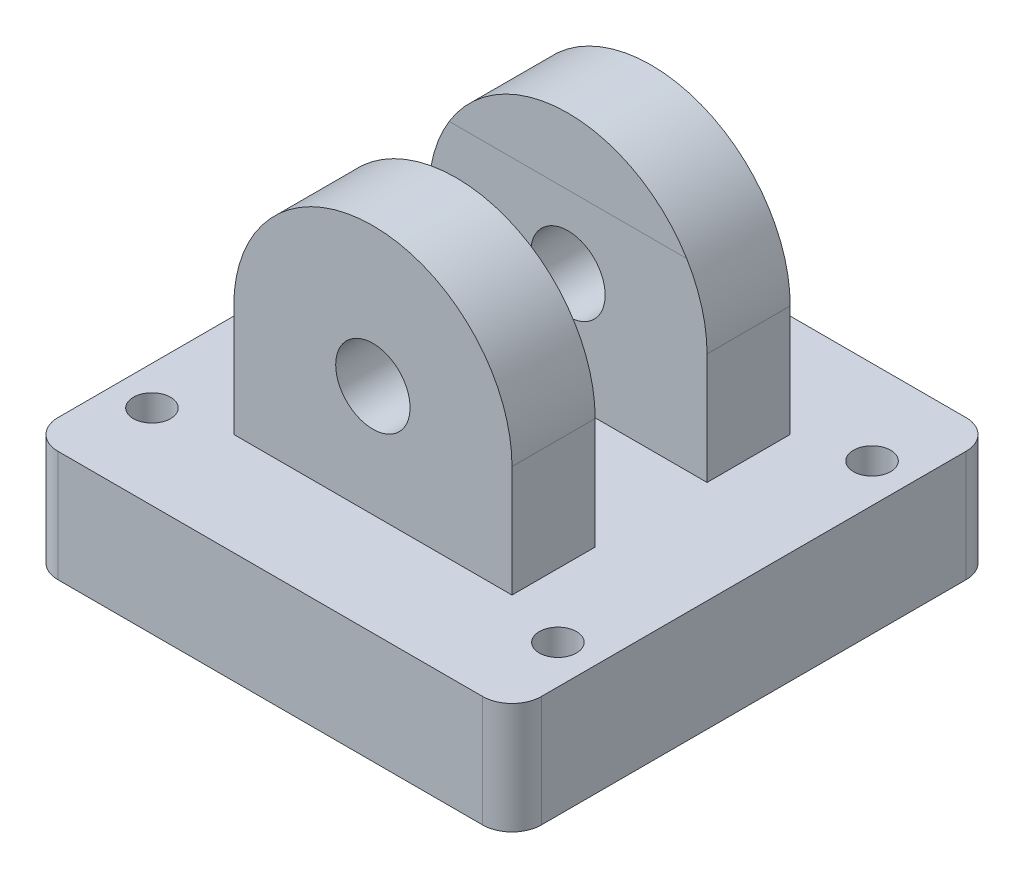
from build123d import *

# Parameters (mm, degrees)
SKETCH1_W                              = 165
SKETCH1_H                              = 165
BOSS_EXTRUDE1_DEPTH                    = 38
SKETCH2_W                              = 95
SKETCH2_H                              = 95
BOSS_EXTRUDE2_DEPTH                    = 38
BOSS_EXTRUDE4_DEPTH                    = 95
SKETCH5_R                              = 12.7
CUT_EXTRUDE1_DEPTH                     = 198.379076905
CUT_EXTRUDE2_DEPTH                     = 222.998873871
CUT_EXTRUDE2_DEPTH_BACK                = 222.998873871
FILLET1_R                              = 10
FILLET2_R                              = 10
SKETCH9_R                              = 26
CUT_EXTRUDE3_DEPTH                     = 36.83
SKETCH10_R                             = 76.2
SKETCH10_R_2                           = 69.85
CUT_EXTRUDE4_DEPTH                     = 10
F_1_2_14_NPSM_TAPPED_HOLE1_D           = 18.9738
F_1_2_14_NPSM_TAPPED_HOLE1_DEPTH       = 63.5
F_1_2_14_NPSM_TAPPED_HOLE1_CSINK_D     = 22.1742
F_1_2_14_NPSM_TAPPED_HOLE1_CSINK_ANGLE = 90
F_1_2_14_NPSM_TAPPED_HOLE1_TIP         = 5.700304607
SKETCH13_R                             = 6.35
CUT_EXTRUDE5_DEPTH                     = 25
SKETCH14_R                             = 6.35
CUT_EXTRUDE7_DEPTH                     = 170.896291896


with BuildPart() as part:
    # Sketch1 → Boss-Extrude1 (new body)
    with BuildSketch(Plane(origin=(0, 0, 0), x_dir=(1, 0, 0), z_dir=(0, 1, 0))):
        Rectangle(SKETCH1_W, SKETCH1_H)
    extrude(amount=BOSS_EXTRUDE1_DEPTH)

    # Sketch2 → Boss-Extrude2 (add)
    with BuildSketch(Plane(origin=(0, 38, 0), x_dir=(1, 0, 0), z_dir=(0, 1, 0))):
        Rectangle(SKETCH2_W, SKETCH2_H)
    extrude(amount=BOSS_EXTRUDE2_DEPTH)

    # Sketch3 → Boss-Extrude4 (add)
    with BuildSketch(Plane(origin=(0, 0, -47.5), x_dir=(-1, 0, 0), z_dir=(0, 0, -1))):
        with BuildLine():
            Line((-47.5, 76), (47.5, 76))
            ThreePointArc((47.5, 76), (0, 123.5), (-47.5, 76))
        make_face()
    extrude(amount=-BOSS_EXTRUDE4_DEPTH)

    # Sketch5 → Cut-Extrude1 (cut, through all)
    with BuildSketch(Plane(origin=(0, 0, -47.5), x_dir=(-1, 0, 0), z_dir=(0, 0, -1))):
        with Locations((0, 76)):
            Circle(SKETCH5_R)
    extrude(amount=-CUT_EXTRUDE1_DEPTH, mode=Mode.SUBTRACT)

    # Sketch8 → Cut-Extrude2 (cut, two sides: drawn at the far end of the back side and taken through both)
    with BuildSketch(Plane(origin=(82.5, 0, 0), x_dir=(0, 0, -1), z_dir=(1, 0, 0)).offset(-CUT_EXTRUDE2_DEPTH_BACK)):
        Polygon((-19.102036328, 453.345111178), (-19.102036328, 123.5), (-19.102036328, 100.748776974), (-19.102036328, 38), (19.102036328, 38), (19.102036328, 100.748776974), (19.102036328, 123.5), (19, 123.5), (-19, 123.5), (-348.845111178, 123.5), (117.698474691, -342.899262388), (447.44154954, -13.05415121), align=None)
    extrude(amount=CUT_EXTRUDE2_DEPTH + CUT_EXTRUDE2_DEPTH_BACK, mode=Mode.SUBTRACT)

    # Fillet1
    fillet1_edges = [part.edges().sort_by_distance(p)[0] for p in [
        (82.5, 19, 82.5),
    ]]
    fillet(fillet1_edges, radius=FILLET1_R)

    # Fillet2
    fillet2_edges = [part.edges().sort_by_distance(p)[0] for p in [
        (-82.5, 19, 82.5),
        (-82.5, 19, -82.5),
        (82.5, 19, -82.5),
    ]]
    fillet(fillet2_edges, radius=FILLET2_R)

    # Sketch9 → Cut-Extrude3 (cut)
    with BuildSketch(Plane.XZ):
        with Locations(Location((0, 0, 0), (0, 0, 270))):
            Circle(SKETCH9_R)
    extrude(amount=-CUT_EXTRUDE3_DEPTH, mode=Mode.SUBTRACT)

    # Sketch10 → Cut-Extrude4 (cut)
    with BuildSketch(Plane.XZ):
        with Locations(Location((0, 0, 0), (0, 0, 270))):
            Circle(SKETCH10_R)
        with Locations(Location((0, 0, 0), (0, 0, 270))):
            Circle(SKETCH10_R_2, mode=Mode.SUBTRACT)
    extrude(amount=-CUT_EXTRUDE4_DEPTH, mode=Mode.SUBTRACT)

    # 1/2-14 NPSM Tapped Hole1
    with Locations(Plane(origin=(-0.938861221, 19, -82.5), x_dir=(-1, 0, 0), z_dir=(0, 0, -1))):
        with Locations((0, 0)):
            CounterSinkHole(F_1_2_14_NPSM_TAPPED_HOLE1_D / 2, F_1_2_14_NPSM_TAPPED_HOLE1_CSINK_D / 2, depth=F_1_2_14_NPSM_TAPPED_HOLE1_DEPTH, counter_sink_angle=F_1_2_14_NPSM_TAPPED_HOLE1_CSINK_ANGLE)
            with Locations((0, 0, -(F_1_2_14_NPSM_TAPPED_HOLE1_DEPTH + F_1_2_14_NPSM_TAPPED_HOLE1_TIP / 2))):  # 118° drill point
                Cone(0, F_1_2_14_NPSM_TAPPED_HOLE1_D / 2, F_1_2_14_NPSM_TAPPED_HOLE1_TIP, mode=Mode.SUBTRACT)

    # Sketch13 → Cut-Extrude5 (cut)
    with BuildSketch(Plane.XZ):
        with Locations(Location((0, -50.5, 0), (0, 0, 270))):
            Circle(SKETCH13_R)
    extrude(amount=-CUT_EXTRUDE5_DEPTH, mode=Mode.SUBTRACT)

    # Sketch14 → Cut-Extrude7 (cut, through all)
    with BuildSketch(Plane.XZ):
        with Locations(Location((-69.30177445, 53.630970139, 0), (0, 0, 270))):
            Circle(SKETCH14_R)
        with Locations(Location((-69.30177445, -53.630970139, 0), (0, 0, 270))):
            Circle(SKETCH14_R)
        with Locations(Location((69.30177445, -53.630970139, 0), (0, 0, 270))):
            Circle(SKETCH14_R)
        with Locations(Location((69.30177445, 53.630970139, 0), (0, 0, 270))):
            Circle(SKETCH14_R)
    extrude(amount=-CUT_EXTRUDE7_DEPTH, mode=Mode.SUBTRACT)


solid = part.part
